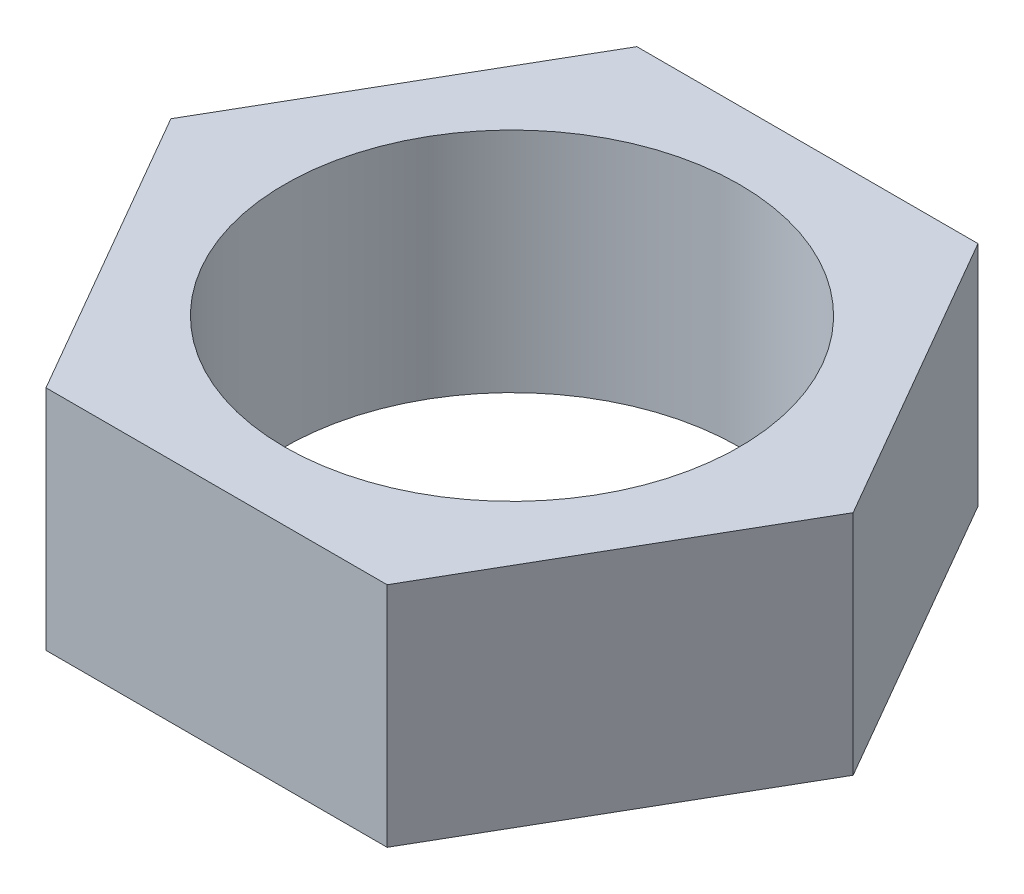
from build123d import *

# Parameters (mm, degrees)
SKETCH_1_R      = 2
EXTRUDE_1_DEPTH = 2


with BuildPart() as part:
    # 草图1 → 凸台-拉伸1 (new body)
    with BuildSketch(Plane(origin=(0, 0, 0), x_dir=(1, 0, 0), z_dir=(0, 1, 0))):
        Polygon((1.5, 2.598076211), (-1.5, 2.598076211), (-3, 0), (-1.5, -2.598076211), (1.5, -2.598076211), (3, 0), align=None)
        with Locations(Location((0, 0, 0), (0, 0, 270))):
            Circle(SKETCH_1_R, mode=Mode.SUBTRACT)
    extrude(amount=EXTRUDE_1_DEPTH)


solid = part.part
